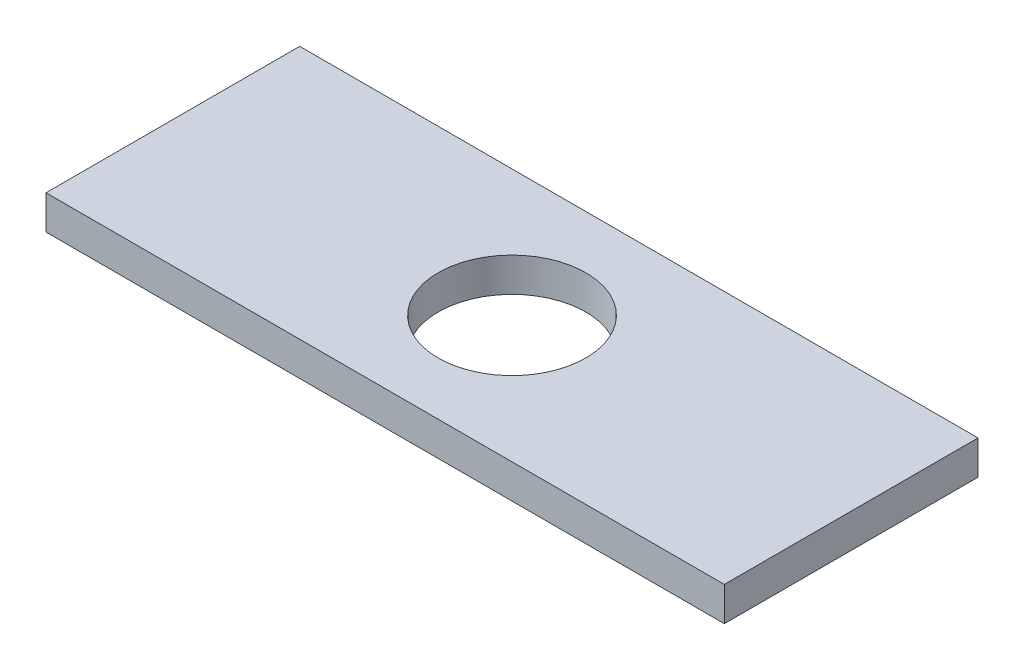
from build123d import *

# Parameters (mm, degrees)
SKETCH3_W           = 298.9982585
SKETCH3_H           = 111.820365486
BOSS_EXTRUDE2_DEPTH = 15
SKETCH4_R           = 32.55
CUT_EXTRUDE1_DEPTH  = 15


with BuildPart() as part:
    # Sketch3 → Boss-Extrude2 (new body)
    with BuildSketch(Plane(origin=(0, 0, 0), x_dir=(1, 0, 0), z_dir=(0, 1, 0))):
        Rectangle(SKETCH3_W, SKETCH3_H)
    extrude(amount=BOSS_EXTRUDE2_DEPTH)

    # Sketch4 → Cut-Extrude1 (cut)
    with BuildSketch(Plane(origin=(0, 15, 0), x_dir=(1, 0, 0), z_dir=(0, 1, 0))):
        with Locations(Location((0, 0, 0), (0, 0, 270))):
            Circle(SKETCH4_R)
    extrude(amount=-CUT_EXTRUDE1_DEPTH, mode=Mode.SUBTRACT)


solid = part.part
